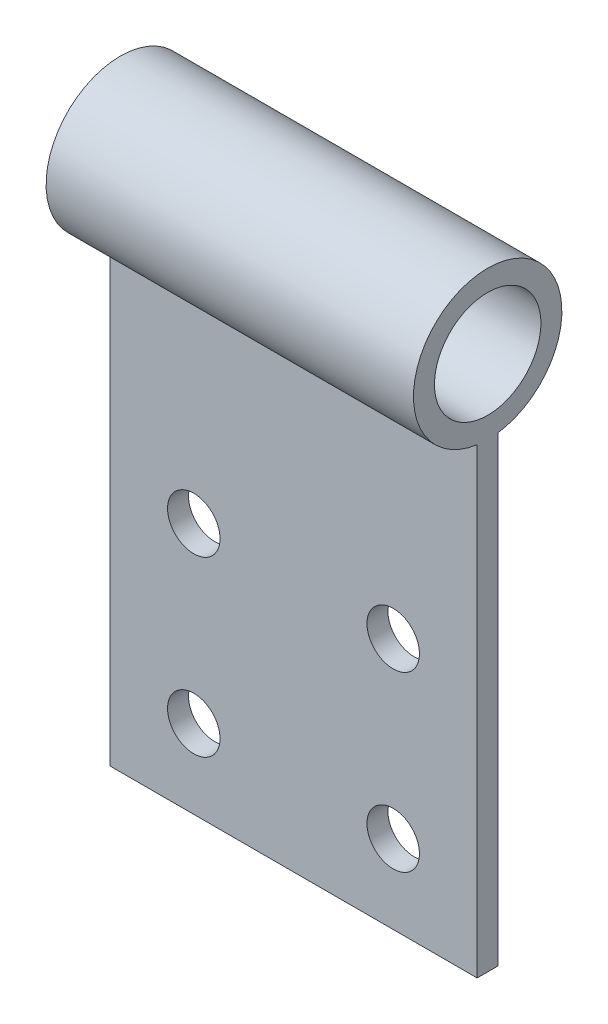
from build123d import *

# Parameters (mm, degrees)
SKETCH1_W           = 35
SKETCH1_H           = 40
BOSS_EXTRUDE1_DEPTH = 2
SKETCH2_R           = 2.5
CUT_EXTRUDE1_DEPTH  = 54.188344588
SKETCH3_R           = 5.071067812
BOSS_EXTRUDE2_DEPTH = 35


with BuildPart() as part:
    # Sketch1 → Boss-Extrude1 (new body)
    with BuildSketch(Plane.XY):
        with Locations((17.5, 20)):
            Rectangle(SKETCH1_W, SKETCH1_H)
    extrude(amount=BOSS_EXTRUDE1_DEPTH)

    # Sketch2 → Cut-Extrude1 (cut, through all)
    with BuildSketch(Plane(origin=(0, 0, 0), x_dir=(-1, 0, 0), z_dir=(0, 0, -1))):
        with Locations((-27, 24)):
            Circle(SKETCH2_R)
        with Locations((-8, 24)):
            Circle(SKETCH2_R)
        with Locations((-8, 7.5)):
            Circle(SKETCH2_R)
        with Locations((-27, 7.5)):
            Circle(SKETCH2_R)
    extrude(amount=-CUT_EXTRUDE1_DEPTH, mode=Mode.SUBTRACT)

    # Sketch3 → Boss-Extrude2 (add)
    with BuildSketch(Plane.ZY):
        with BuildLine():
            Line((0, 40), (2, 40))
            Line((2, 40), (2, 44))
            ThreePointArc((2, 44), (1, 58.071067812), (0, 44))
            Line((0, 44), (0, 40))
        make_face()
        with Locations((1, 51)):
            Circle(SKETCH3_R, mode=Mode.SUBTRACT)
    extrude(amount=-BOSS_EXTRUDE2_DEPTH)


solid = part.part
